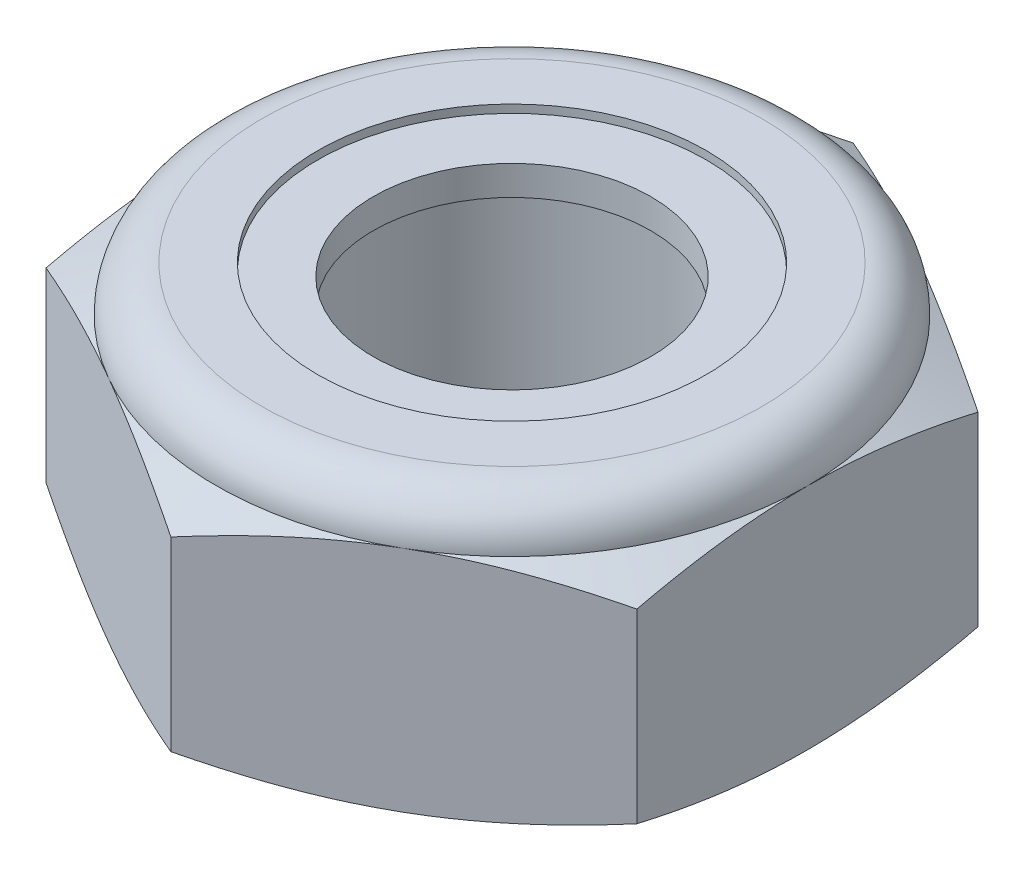
from build123d import *

# Parameters (mm, degrees)
EXTRUDE1_DEPTH = 5.159375
SKETCH2_W      = 3.175
SKETCH2_H      = 5.159375


with BuildPart() as part:
    # Sketch1 → Extrude1 (new body)
    with BuildSketch(Plane(origin=(0, 0, 0), x_dir=(1, 0, 0), z_dir=(0, 1, 0))):
        Polygon((0, 6.415804866), (-5.55625, 3.207902433), (-5.55625, -3.207902433), (0, -6.415804866), (5.55625, -3.207902433), (5.55625, 3.207902433), align=None)
    extrude(amount=EXTRUDE1_DEPTH)


with BuildPart() as body_2:
    # Sketch2 → Revolve1 (revolve)
    with BuildSketch(Plane(origin=(0, 0, 0), x_dir=(0, 0, -1), z_dir=(1, 0, 0))):
        with Locations((1.5875, 2.5796875)):
            Rectangle(SKETCH2_W, SKETCH2_H)
    revolve(axis=Axis((0, -3.175, 0), (0, 1, 0)))


with BuildPart() as part_1:
    add(part.part)

    # Combine1: cut body 2
    add(body_2.part, mode=Mode.SUBTRACT)

    # Sketch5 → Cut-Revolve3 (revolve, cut)
    with BuildSketch(Plane(origin=(0, 0, 0), x_dir=(0, 0, -1), z_dir=(1, 0, 0))):
        with BuildLine():
            Line((0, 0), (5.55625, 0))
            Line((5.55625, 0), (6.415804866, 0.400817017))
            Line((6.415804866, 0.400817017), (6.415804866, 3.89866215))
            Line((6.415804866, 3.89866215), (5.55625, 4.299479167))
            ThreePointArc((5.55625, 4.299479167), (5.304392342, 4.907517342), (4.696354167, 5.159375))
            Line((4.696354167, 5.159375), (4.696354167, 6.429375))
            Line((4.696354167, 6.429375), (7.685804866, 6.429375))
            Line((7.685804866, 6.429375), (7.685804866, -1.27))
            Line((7.685804866, -1.27), (0, -1.27))
            Line((0, -1.27), (0, 0))
        make_face()
    revolve(axis=Axis((0, 0, 0), (0, 1, 0)), mode=Mode.SUBTRACT)

    # Sketch6 → Cut-Revolve4 (revolve, cut)
    with BuildSketch(Plane(origin=(0, 0, 0), x_dir=(0, 0, -1), z_dir=(1, 0, 0))):
        with BuildLine():
            Line((0, 4.299479167), (5.40385, 4.299479167))
            ThreePointArc((5.40385, 4.299479167), (5.196629268, 4.799754268), (4.696354167, 5.006975))
            Line((4.696354167, 5.006975), (3.653131261, 5.006975))
            Line((3.653131261, 5.006975), (3.653131261, 6.429375))
            Line((3.653131261, 6.429375), (0, 6.429375))
            Line((0, 6.429375), (0, 4.299479167))
        make_face()
    revolve(axis=Axis((0, 6.429375, 0), (0, 1, 0)), mode=Mode.SUBTRACT)


with BuildPart() as body_2_2:
    # Sketch7 → Revolve2 (revolve)
    with BuildSketch(Plane(origin=(0, 0, 0), x_dir=(0, 0, -1), z_dir=(1, 0, 0))):
        with BuildLine():
            Line((2.609908356, 4.375679167), (5.3230343, 4.375679167))
            ThreePointArc((5.3230343, 4.375679167), (5.114940888, 4.772046184), (4.696354167, 4.930775))
            Line((4.696354167, 4.930775), (2.609908356, 4.930775))
            Line((2.609908356, 4.930775), (2.609908356, 4.375679167))
        make_face()
    revolve(axis=Axis((0, 4.375679167, 0), (0, 1, 0)))


solid = Compound([part_1.part, body_2_2.part])
